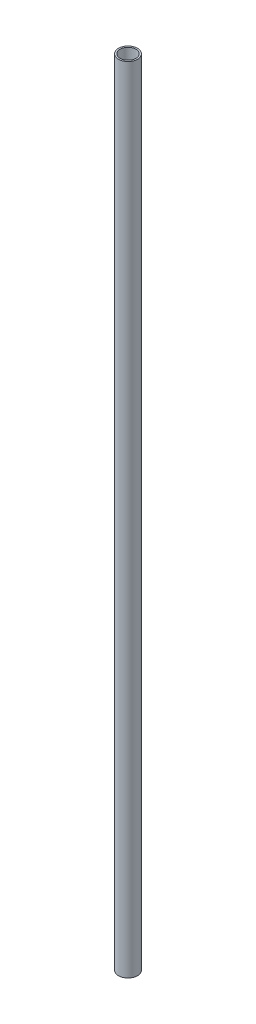
from build123d import *

# Parameters (mm, degrees)
SKETCH_1_R      = 6
SKETCH_1_R_2    = 5
EXTRUDE_1_DEPTH = 500


with BuildPart() as part:
    # 草图1 → 凸台-拉伸1 (new body)
    with BuildSketch(Plane(origin=(0, 0, 0), x_dir=(1, 0, 0), z_dir=(0, 1, 0))):
        with Locations(Location((0, 0, 0), (0, 0, 270))):
            Circle(SKETCH_1_R)
        with Locations(Location((0, 0, 0), (0, 0, 270))):
            Circle(SKETCH_1_R_2, mode=Mode.SUBTRACT)
    extrude(amount=EXTRUDE_1_DEPTH)


solid = part.part
